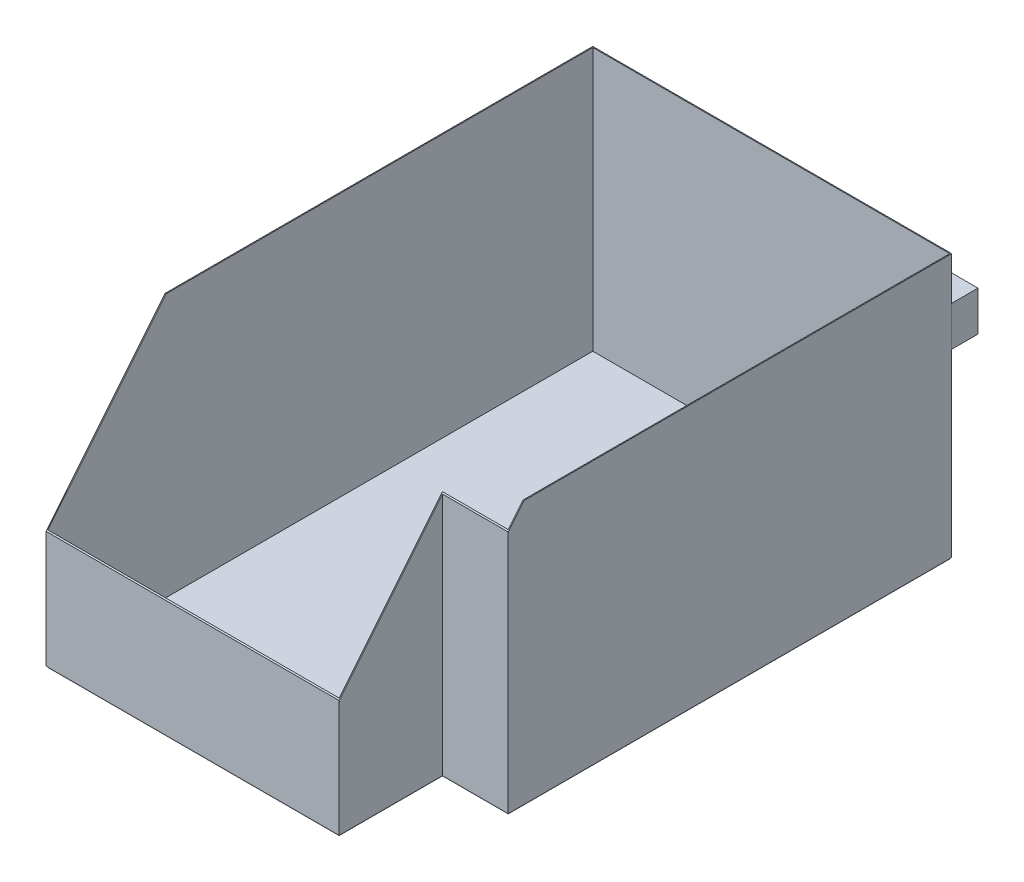
from build123d import *

# Parameters (mm, degrees)
BOSS_EXTRUDE1_DEPTH     = 1.5
BOSS_EXTRUDE2_DEPTH     = 280
SKETCH4_W               = 380
SKETCH4_H               = 42.385541564
BOSS_EXTRUDE3_DEPTH     = 30
CUT_EXTRUDE1_DEPTH      = 629.582338515
CUT_EXTRUDE1_DEPTH_BACK = 629.582338515


with BuildPart() as part:
    # Sketch1 → Boss-Extrude1 (new body)
    with BuildSketch(Plane(origin=(0, 0, 0), x_dir=(1, 0, 0), z_dir=(0, 1, 0))):
        Polygon((-147.151383235, 167.826300096), (232.848616765, 167.826300096), (232.848616765, -302.173699904), (162.848616765, -302.173699904), (162.848616765, -412.173699904), (-147.151383235, -412.173699904), align=None)
    extrude(amount=BOSS_EXTRUDE1_DEPTH)


with BuildPart() as body_2:
    # Sketch2 → Boss-Extrude2 (new body)
    with BuildSketch(Plane(origin=(0, 1.5, 0), x_dir=(1, 0, 0), z_dir=(0, 1, 0))):
        Polygon((-148.151383235, -413.173699904), (163.848616765, -413.173699904), (163.848616765, -303.173699904), (233.848616765, -303.173699904), (233.848616765, 168.826300096), (-148.151383235, 168.826300096), align=None)
        Polygon((-147.151383235, 167.826300096), (-147.151383235, -412.173699904), (162.848616765, -412.173699904), (162.848616765, -302.173699904), (232.848616765, -302.173699904), (232.848616765, 167.826300096), align=None, mode=Mode.SUBTRACT)
    extrude(amount=BOSS_EXTRUDE2_DEPTH)

    # Sketch3 → Cut-Extrude1 (cut, two sides: drawn at the far end of the back side and taken through both)
    with BuildSketch(Plane.ZY.offset(147.151383235).offset(-CUT_EXTRUDE1_DEPTH_BACK)):
        Polygon((413.173699904, 125.528052126), (286.395099081, 281.5), (413.173699904, 281.5), align=None)
    extrude(amount=CUT_EXTRUDE1_DEPTH + CUT_EXTRUDE1_DEPTH_BACK, mode=Mode.SUBTRACT)


with BuildPart() as body_3:
    # Sketch4 → Boss-Extrude3 (new body)
    with BuildSketch(Plane(origin=(0, 0, -167.826300096), x_dir=(-1, 0, 0), z_dir=(0, 0, -1))):
        with Locations((-42.848616765, 213.483316708)):
            Rectangle(SKETCH4_W, SKETCH4_H)
    extrude(amount=BOSS_EXTRUDE3_DEPTH)


solid = Compound([part.part, body_2.part, body_3.part])
